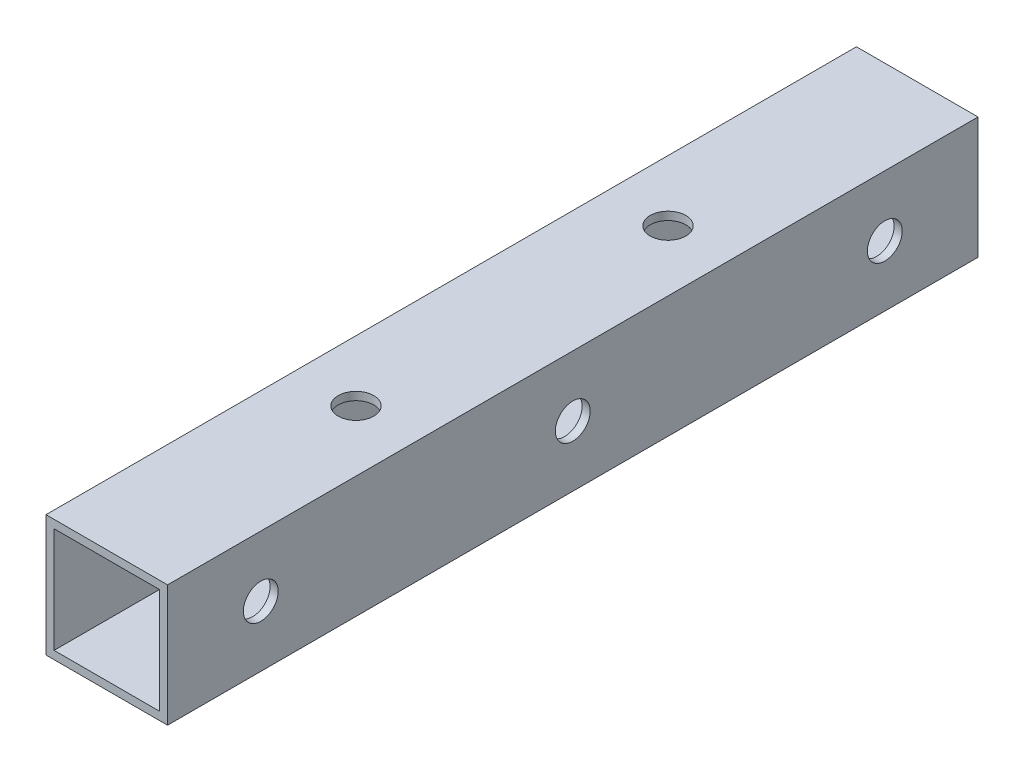
from build123d import *

# Parameters (mm, degrees)
SKETCH_1_W          = 15
SKETCH_1_H          = 15
SKETCH_1_W_2        = 13
SKETCH_1_H_2        = 13
EXTRUDE_1_DEPTH     = 100
SKETCH_2_R          = 2.15
CUT_EXTRUDE_1_DEPTH = 366
SKETCH_3_R          = 2.2
CUT_EXTRUDE_2_DEPTH = 55


with BuildPart() as part:
    # 草图1 → 凸台-拉伸1 (new body)
    with BuildSketch(Plane.XY):
        Rectangle(SKETCH_1_W, SKETCH_1_H)
        Rectangle(SKETCH_1_W_2, SKETCH_1_H_2, mode=Mode.SUBTRACT)
    extrude(amount=EXTRUDE_1_DEPTH)

    # 草图2 → 切除-拉伸1 (cut)
    with BuildSketch(Plane(origin=(7.5, 0, 0), x_dir=(0, 0, -1), z_dir=(1, 0, 0))):
        with Locations(Location((-50, 0, 0), (0, 0, 90))):
            Circle(SKETCH_2_R)
        with Locations(Location((-88.5, 0, 0), (0, 0, 90))):
            Circle(SKETCH_2_R)
        with Locations(Location((-11.5, 0, 0), (0, 0, 90))):
            Circle(SKETCH_2_R)
    extrude(amount=-CUT_EXTRUDE_1_DEPTH, mode=Mode.SUBTRACT)

    # 草图3 → 切除-拉伸2 (cut)
    with BuildSketch(Plane(origin=(0, 7.5, 0), x_dir=(1, 0, 0), z_dir=(0, 1, 0))):
        with Locations(Location((0, -30.75, 0), (0, 0, 270))):
            Circle(SKETCH_3_R)
        with Locations(Location((0, -69.25, 0), (0, 0, 270))):
            Circle(SKETCH_3_R)
    extrude(amount=-CUT_EXTRUDE_2_DEPTH, mode=Mode.SUBTRACT)


solid = part.part
